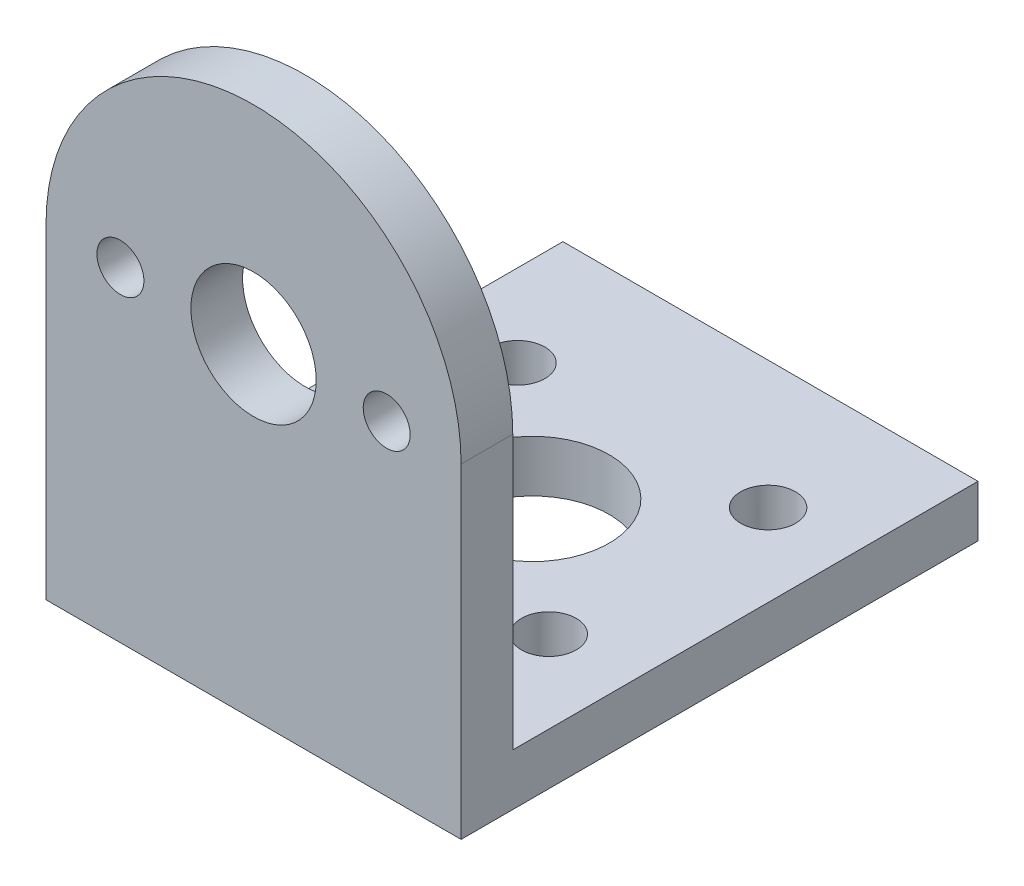
from build123d import *

# Parameters (mm, degrees)
SKETCH_1_R          = 4
SKETCH_1_R_2        = 1.5
EXTRUDE_1_DEPTH     = 3.3
SKETCH_2_W          = 26.5
SKETCH_2_H          = 3.3
EXTRUDE_2_DEPTH     = 29.7
SKETCH_3_R          = 4.9
SKETCH_3_R_2        = 1.75
CUT_EXTRUDE_1_DEPTH = 3.3


with BuildPart() as part:
    # 草图1 → 凸台-拉伸1 (new body)
    with BuildSketch(Plane.XY):
        with BuildLine():
            Line((-13.25, 0), (-13.25, -20.75))
            Line((-13.25, -20.75), (13.25, -20.75))
            Line((13.25, -20.75), (13.25, 0))
            ThreePointArc((13.25, 0), (0, 13.25), (-13.25, 0))
        make_face()
        Circle(SKETCH_1_R, mode=Mode.SUBTRACT)
        with Locations((-8.5, 0)):
            Circle(SKETCH_1_R_2, mode=Mode.SUBTRACT)
        with Locations(Location((8.5, 0, 0), (0, 0, 180))):
            Circle(SKETCH_1_R_2, mode=Mode.SUBTRACT)
    extrude(amount=EXTRUDE_1_DEPTH)

    # 草图2 → 凸台-拉伸2 (add)
    with BuildSketch(Plane.XY):
        with Locations((0, -19.1)):
            Rectangle(SKETCH_2_W, SKETCH_2_H)
    extrude(amount=-EXTRUDE_2_DEPTH)

    # 草图3 → 切除-拉伸1 (cut)
    with BuildSketch(Plane(origin=(0, -17.45, 0), x_dir=(1, 0, 0), z_dir=(0, 1, 0))):
        with Locations(Location((0, 14.5, 0), (0, 0, 180))):
            Circle(SKETCH_3_R)
        with Locations(Location((-8, 21.55, 0), (0, 0, 180))):
            Circle(SKETCH_3_R_2)
        with Locations(Location((-8, 7.55, 0), (0, 0, 180))):
            Circle(SKETCH_3_R_2)
        with Locations(Location((8, 7.55, 0), (0, 0, 270))):
            Circle(SKETCH_3_R_2)
        with Locations(Location((8, 21.55, 0), (0, 0, 270))):
            Circle(SKETCH_3_R_2)
    extrude(amount=-CUT_EXTRUDE_1_DEPTH, mode=Mode.SUBTRACT)


solid = part.part
